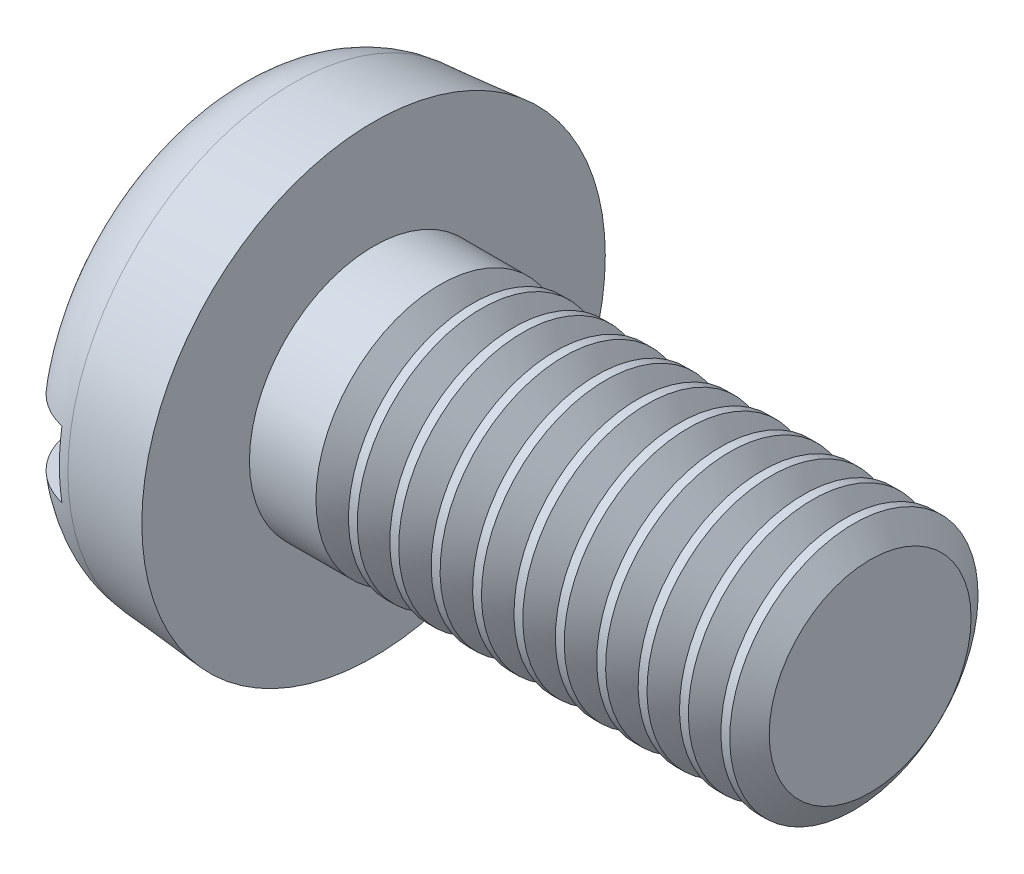
from build123d import *

# Parameters (mm, degrees)
FILLET2_R       = 0.9
SKETCH2_W       = 5.6
SKETCH2_H       = 0.8
SLOT_DEPTH      = 0.7
THDSCHPAT_COUNT = 11
THDSCHPAT_PITCH = 0.5


with BuildPart() as part:
    # BodySke → Base-Revolve (revolve)
    with BuildSketch(Plane.XY, mode=Mode.PRIVATE) as base_revolve_sk:
        Polygon((1.8, 1.5), (1.8, 2.8), (0, 2.642520406), (0, 0), (7.8, 0), (7.8, 1.5), align=None)
    revolve(base_revolve_sk.sketch.rotate(Axis((-25.4, 0, 0), (1, 0, 0)), 90), axis=Axis((-25.4, 0, 0), (1, 0, 0)))

    # Fillet2
    fillet2_edges = [part.edges().sort_by_distance(p)[0] for p in [
        (0, 0, -2.642520406),
    ]]
    fillet(fillet2_edges, radius=FILLET2_R)

    # Sketch2 → Slot (cut)
    with BuildSketch(Plane(origin=(0, 0, 0), x_dir=(0, 0, -1), z_dir=(1, 0, 0))):
        Rectangle(SKETCH2_W, SKETCH2_H)
    extrude(amount=SLOT_DEPTH, mode=Mode.SUBTRACT)

    # ThdSchSke → ThreadSchematic (revolve, cut)
    with BuildSketch(Plane.XY):
        Polygon((2.8, -1.2195), (2.603591786, -1.5), (2.603591786, -1.875), (2.996408214, -1.875), (2.996408214, -1.5), align=None)
    threadschematic = revolve(axis=Axis((-3.175, 0, 0), (1, 0, 0)), mode=Mode.SUBTRACT)

    # ThdSchPat: ThreadSchematic ×11
    with Locations(*[(i * THDSCHPAT_PITCH, 0, 0) for i in range(1, THDSCHPAT_COUNT)]):
        add(threadschematic, mode=Mode.SUBTRACT)


solid = part.part
